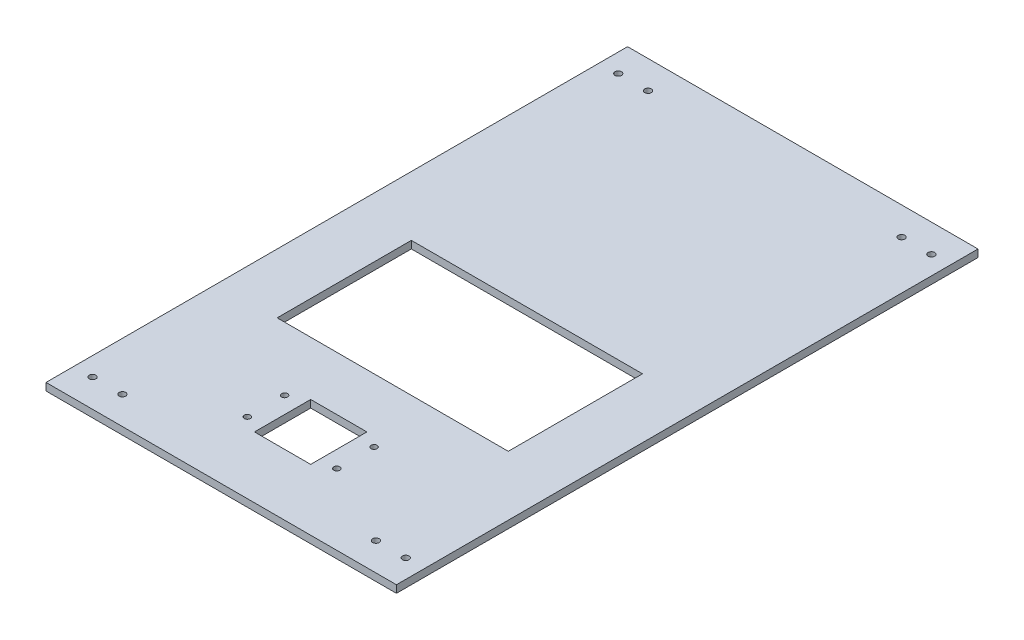
from build123d import *

# Parameters (mm, degrees)
SKETCH1_W                  = 298.45
SKETCH1_H                  = 495.3
BOSS_EXTRUDE1_DEPTH        = 3.175
CUT_EXTRUDE1_DEPTH         = 290.203986184
CUT_EXTRUDE1_DEPTH_BACK    = 290.203986184
SKETCH3_W                  = 196.85
SKETCH3_H                  = 114.3
F_12_CLEARANCE_HOLE2_D     = 5.6134
F_12_CLEARANCE_HOLE2_DEPTH = 16.51
F_12_CLEARANCE_HOLE2_TIP   = 1.686435499
SKETCH20_W                 = 47.879
SKETCH20_H                 = 47.879
CUT_EXTRUDE5_DEPTH         = 290.203986184
F_10_CLEARANCE_HOLE1_D     = 5.1054
F_10_CLEARANCE_HOLE1_DEPTH = 10.668
F_10_CLEARANCE_HOLE1_TIP   = 1.533816902


with BuildPart() as part:
    # Sketch1 → Boss-Extrude1 (new, symmetric)
    with BuildSketch(Plane(origin=(0, 0, 0), x_dir=(1, 0, 0), z_dir=(0, 1, 0))):
        Rectangle(SKETCH1_W, SKETCH1_H)
    extrude(amount=BOSS_EXTRUDE1_DEPTH, both=True)

    # Sketch3 → Cut-Extrude1 (cut, two sides: drawn at the far end of the back side and taken through both)
    with BuildSketch(Plane(origin=(0, 3.175, 0), x_dir=(1, 0, 0), z_dir=(0, 1, 0)).offset(-CUT_EXTRUDE1_DEPTH_BACK)):
        with Locations((0, -44.45)):
            Rectangle(SKETCH3_W, SKETCH3_H)
    extrude(amount=CUT_EXTRUDE1_DEPTH + CUT_EXTRUDE1_DEPTH_BACK, mode=Mode.SUBTRACT)

    # #12 Clearance Hole2
    with Locations(Plane(origin=(0, -3.175, 0), x_dir=(-1, 0, 0), z_dir=(0, -1, 0))):
        with Locations((107.95, -223.8375), (133.35, -223.8375), (133.35, 223.8375), (107.95, 223.8375), (-133.35, 223.8375), (-107.95, 223.8375), (-133.35, -223.8375), (-107.95, -223.8375)):
            Hole(F_12_CLEARANCE_HOLE2_D / 2, depth=F_12_CLEARANCE_HOLE2_DEPTH)
            with Locations((0, 0, -(F_12_CLEARANCE_HOLE2_DEPTH + F_12_CLEARANCE_HOLE2_TIP / 2))):  # 118° drill point
                Cone(0, F_12_CLEARANCE_HOLE2_D / 2, F_12_CLEARANCE_HOLE2_TIP, mode=Mode.SUBTRACT)

    # Sketch20 → Cut-Extrude5 (cut, through all)
    with BuildSketch(Plane.XZ.offset(3.175)):
        with Locations((0, 171.45)):
            Rectangle(SKETCH20_W, SKETCH20_H)
    extrude(amount=-CUT_EXTRUDE5_DEPTH, mode=Mode.SUBTRACT)

    # #10 Clearance Hole1
    with Locations(Plane(origin=(0, -3.175, 0), x_dir=(-1, 0, 0), z_dir=(0, -1, 0))):
        with Locations((-38.1, -155.575), (38.1, -155.575), (38.1, -187.325), (-38.1, -187.325)):
            Hole(F_10_CLEARANCE_HOLE1_D / 2, depth=F_10_CLEARANCE_HOLE1_DEPTH)
            with Locations((0, 0, -(F_10_CLEARANCE_HOLE1_DEPTH + F_10_CLEARANCE_HOLE1_TIP / 2))):  # 118° drill point
                Cone(0, F_10_CLEARANCE_HOLE1_D / 2, F_10_CLEARANCE_HOLE1_TIP, mode=Mode.SUBTRACT)


solid = part.part
